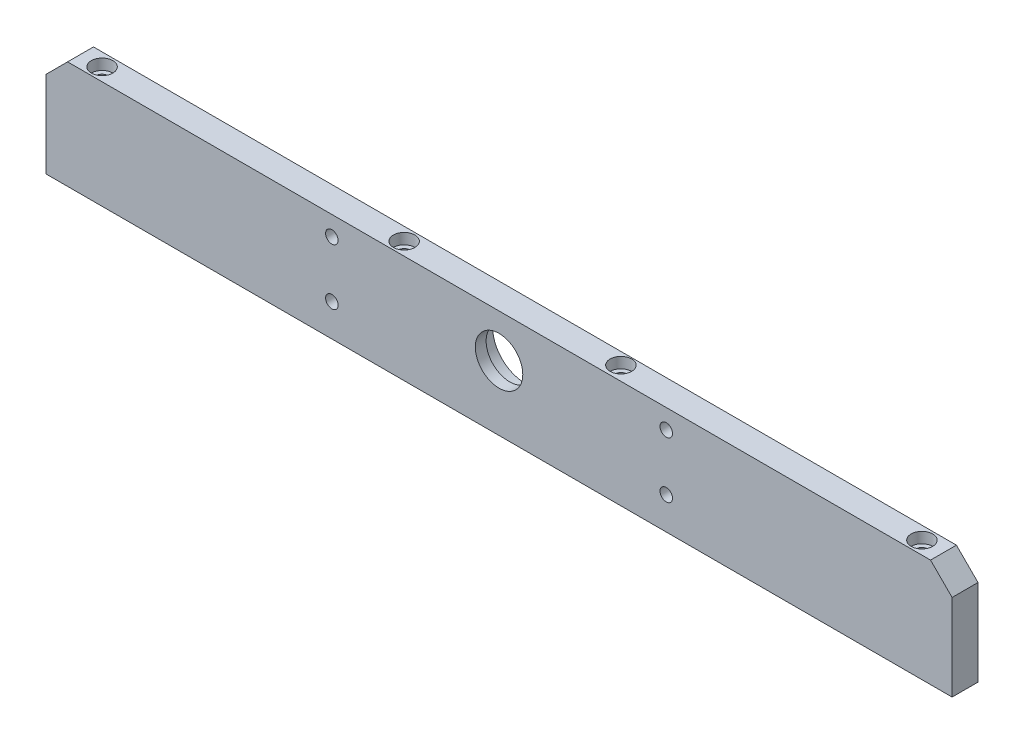
from build123d import *

# Parameters (mm, degrees)
SKETCH_1_W                   = 420
SKETCH_1_H                   = 50
EXTRUDE_1_DEPTH              = 12
CHAMFER_1_SIZE               = 10
SKETCH_2_R                   = 11
CUT_EXTRUDE_1_DEPTH          = 424.135911972
SKETCH_3_R                   = 15
CUT_EXTRUDE_2_DEPTH          = 7
HOLE_WIZARD_M5_1_D           = 5.8
HOLE_WIZARD_M5_1_CBORE_D     = 10
HOLE_WIZARD_M5_1_CBORE_DEPTH = 5
HOLE_WIZARD_M5_2_D           = 5.8
HOLE_WIZARD_M5_2_CBORE_D     = 10
HOLE_WIZARD_M5_2_CBORE_DEPTH = 5
HOLE_WIZARD_M4_1_D           = 3.3
HOLE_WIZARD_M4_1_DEPTH       = 10.1
HOLE_WIZARD_M4_1_TIP         = 0.991420021


with BuildPart() as part:
    # 草图1 → 凸台-拉伸1 (new body)
    with BuildSketch(Plane.XY):
        with Locations((210, 25)):
            Rectangle(SKETCH_1_W, SKETCH_1_H)
    extrude(amount=EXTRUDE_1_DEPTH)

    # 倒角1
    chamfer_1_edges = [part.edges().sort_by_distance(p)[0] for p in [
        (0, 50, 6),
        (420, 50, 6),
    ]]
    chamfer(chamfer_1_edges, length=CHAMFER_1_SIZE)

    # 草图2 → 切除-拉伸1 (cut, through all)
    with BuildSketch(Plane.XY.offset(12)):
        with Locations((210, 30)):
            Circle(SKETCH_2_R)
    extrude(amount=-CUT_EXTRUDE_1_DEPTH, mode=Mode.SUBTRACT)

    # 草图3 → 切除-拉伸2 (cut)
    with BuildSketch(Plane(origin=(0, 0, 0), x_dir=(-1, 0, 0), z_dir=(0, 0, -1))):
        with Locations((-210, 30)):
            Circle(SKETCH_3_R)
    extrude(amount=-CUT_EXTRUDE_2_DEPTH, mode=Mode.SUBTRACT)

    # M5 六角凹头螺钉的柱形沉头孔1 (through all)
    with Locations(Plane(origin=(0, 50, 0), x_dir=(-1, 0, 0), z_dir=(0, 1, 0))):
        with Locations((-20, 6), (-160, 6), (-260, 5.528486678), (-400, 6)):
            CounterBoreHole(HOLE_WIZARD_M5_1_D / 2, HOLE_WIZARD_M5_1_CBORE_D / 2, HOLE_WIZARD_M5_1_CBORE_DEPTH)

    # M5 六角凹头螺钉的柱形沉头孔2 (through all)
    with Locations(Plane(origin=(0, 0, 0), x_dir=(-1, 0, 0), z_dir=(0, 0, -1))):
        with Locations((-287.5, 41), (-287.5, 15), (-132.5, 41), (-132.5, 15)):
            CounterBoreHole(HOLE_WIZARD_M5_2_D / 2, HOLE_WIZARD_M5_2_CBORE_D / 2, HOLE_WIZARD_M5_2_CBORE_DEPTH)

    # M4 螺纹孔1
    with Locations(Plane(origin=(0, 0, 0), x_dir=(-1, 0, 0), z_dir=(0, 0, -1))):
        with Locations((-243, 25.5), (-243, 10.5)):
            Hole(HOLE_WIZARD_M4_1_D / 2, depth=HOLE_WIZARD_M4_1_DEPTH)
            with Locations((0, 0, -(HOLE_WIZARD_M4_1_DEPTH + HOLE_WIZARD_M4_1_TIP / 2))):  # 118° drill point
                Cone(0, HOLE_WIZARD_M4_1_D / 2, HOLE_WIZARD_M4_1_TIP, mode=Mode.SUBTRACT)


solid = part.part
